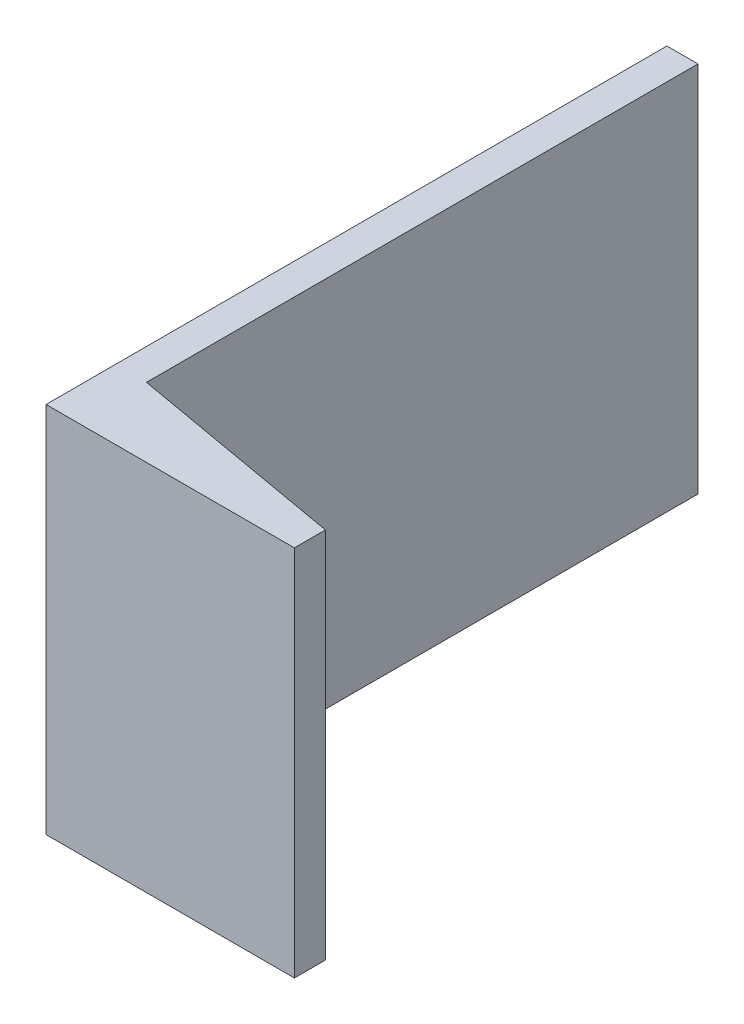
from build123d import *

# Parameters (mm, degrees)
EXTRUDE1_DEPTH = 76.2


with BuildPart() as part:
    # Sketch1 → Extrude1 (new body)
    with BuildSketch(Plane(origin=(0, 0, 0), x_dir=(1, 0, 0), z_dir=(0, 1, 0))):
        Polygon((0, 0), (50.8, 0), (50.8, 6.35), (6.35, 14.187734292), (6.35, 127), (0, 127), align=None)
    extrude(amount=EXTRUDE1_DEPTH)


solid = part.part
